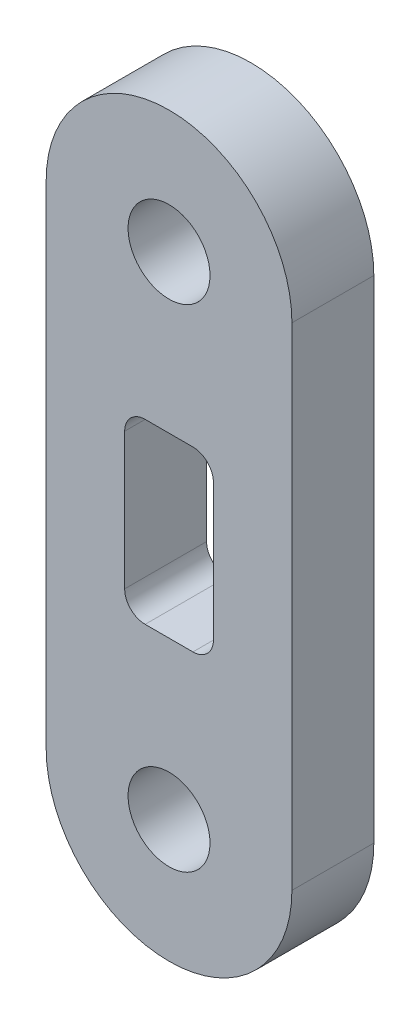
from build123d import *

# Parameters (mm, degrees)
MODEL_R                 = 1.5
SALIENTE_EXTRUIR1_DEPTH = 3


with BuildPart() as part:
    # Model → Saliente-Extruir1 (new body)
    with BuildSketch(Plane.XY):
        with BuildLine():
            Line((213.25077615, 152.428489513), (213.25077615, 170.428489513))
            ThreePointArc((213.25077615, 170.428489513), (208.75077615, 174.928489513), (204.25077615, 170.428489513))
            Line((204.25077615, 170.428489513), (204.25077615, 152.428489513))
            ThreePointArc((204.25077615, 152.428489513), (208.75077615, 147.928489513), (213.25077615, 152.428489513))
        make_face()
        with Locations((208.75077615, 152.428489513)):
            Circle(MODEL_R, mode=Mode.SUBTRACT)
        with Locations((208.75077615, 170.428489513)):
            Circle(MODEL_R, mode=Mode.SUBTRACT)
        with BuildLine():
            Line((207.12577615, 158.928489513), (207.12577615, 163.928489513))
            ThreePointArc((207.12577615, 163.928489513), (207.345446064, 164.458819599), (207.87577615, 164.678489513))
            Line((207.87577615, 164.678489513), (209.62577615, 164.678489513))
            ThreePointArc((209.62577615, 164.678489513), (210.156106235, 164.458819599), (210.37577615, 163.928489513))
            Line((210.37577615, 163.928489513), (210.37577615, 158.928489513))
            ThreePointArc((210.37577615, 158.928489513), (210.156106235, 158.398159427), (209.62577615, 158.178489513))
            Line((209.62577615, 158.178489513), (207.87577615, 158.178489513))
            ThreePointArc((207.87577615, 158.178489513), (207.345446064, 158.398159427), (207.12577615, 158.928489513))
        make_face(mode=Mode.SUBTRACT)
    extrude(amount=SALIENTE_EXTRUIR1_DEPTH)


solid = part.part
